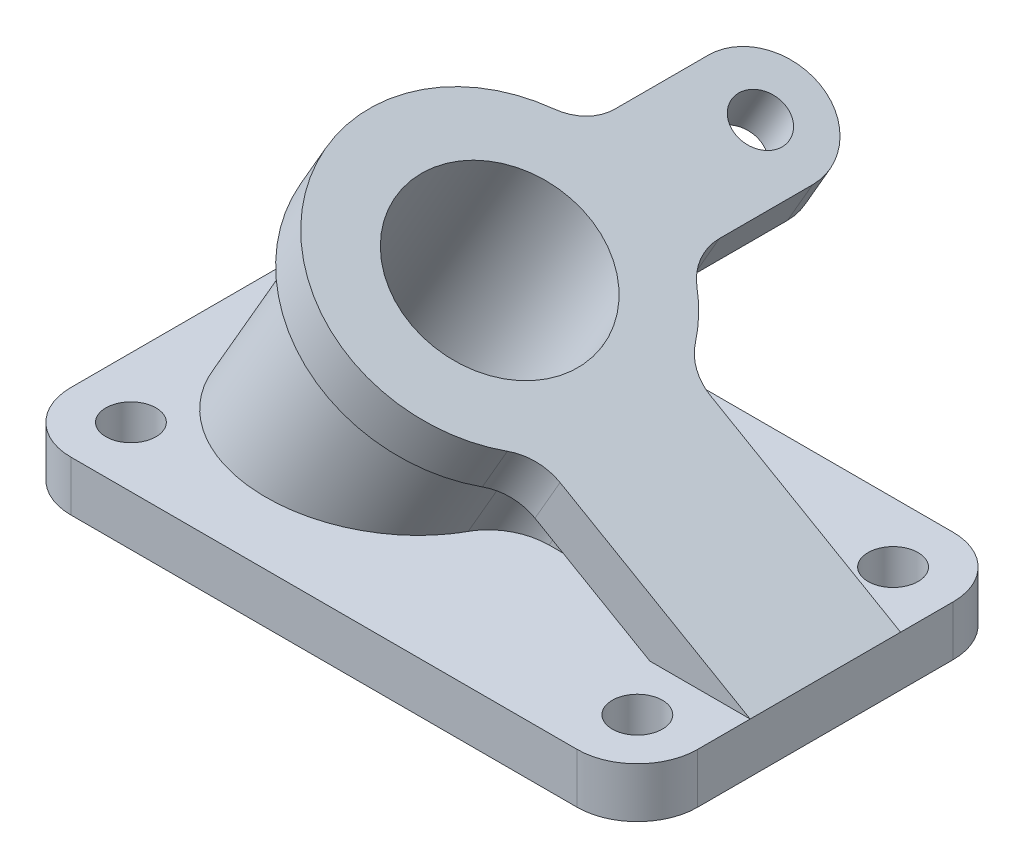
from build123d import *

# Parameters (mm, degrees)
SKETCH_7_R          = 5
EXTRUDE_5_DEPTH     = 10
CUT_EXTRUDE_3_DEPTH = 4
SKETCH_8_R          = 5
EXTRUDE_8_DEPTH     = 10
EXTRUDE_9_REACH     = 111.952
SKETCH_8_6_R        = 18
CUT_EXTRUDE_5_REACH = 111.952
SKETCH_8_7_R        = 18
RIB_9_REACH         = 119.31
SKETCH_10_WALL_W    = 268.526863554
SKETCH_10_WALL_H    = 10


with BuildPart() as part:
    # 草图7 → 凸台-拉伸5 (new body)
    with BuildSketch(Plane(origin=(0, 0, 0), x_dir=(1, 0, 0), z_dir=(0, 1, 0))):
        with BuildLine():
            Line((50.5, 37.5), (-50.5, 37.5))
            ThreePointArc((-50.5, 37.5), (-58.985281374, 33.985281374), (-62.5, 25.5))
            Line((-62.5, 25.5), (-62.5, -25.5))
            ThreePointArc((-62.5, -25.5), (-58.985281374, -33.985281374), (-50.5, -37.5))
            Line((-50.5, -37.5), (50.5, -37.5))
            ThreePointArc((50.5, -37.5), (58.985281374, -33.985281374), (62.5, -25.5))
            Line((62.5, -25.5), (62.5, 25.5))
            ThreePointArc((62.5, 25.5), (58.985281374, 33.985281374), (50.5, 37.5))
        make_face()
        with Locations((-50.5, -25.5)):
            Circle(SKETCH_7_R, mode=Mode.SUBTRACT)
        with Locations((50.5, -25.5)):
            Circle(SKETCH_7_R, mode=Mode.SUBTRACT)
        with Locations((-50.5, 25.5)):
            Circle(SKETCH_7_R, mode=Mode.SUBTRACT)
        with Locations((50.5, 25.5)):
            Circle(SKETCH_7_R, mode=Mode.SUBTRACT)
    extrude(amount=EXTRUDE_5_DEPTH)

    # 草图7<3> → 切除-拉伸3 (cut)
    with BuildSketch(Plane(origin=(0, 0, 0), x_dir=(1, 0, 0), z_dir=(0, 1, 0))):
        with BuildLine():
            Line((38.5, 25.5), (-38.5, 25.5))
            ThreePointArc((-38.5, 25.5), (-42.014718626, 17.014718626), (-50.5, 13.5))
            Line((-50.5, 13.5), (-50.5, -13.5))
            ThreePointArc((-50.5, -13.5), (-42.014718626, -17.014718626), (-38.5, -25.5))
            Line((-38.5, -25.5), (38.5, -25.5))
            ThreePointArc((38.5, -25.5), (42.014718626, -17.014718626), (50.5, -13.5))
            Line((50.5, -13.5), (50.5, 13.5))
            ThreePointArc((50.5, 13.5), (42.014718626, 17.014718626), (38.5, 25.5))
        make_face()
    extrude(amount=CUT_EXTRUDE_3_DEPTH, mode=Mode.SUBTRACT)

    # 草图8 → 凸台-拉伸8 (add)
    with BuildSketch(Plane(origin=(19.955127019, 34.563293868, 0), x_dir=(0, 0, 1), z_dir=(0.500000000000001, 0.866025403784438, 0))):
        with BuildLine():
            Line((-5, 5.749364338), (-5, 49.126587737))
            Line((-5, 49.126587737), (-15, 49.126587737))
            Line((-15, 49.126587737), (-15, 5.351577729))
            ThreePointArc((-15, 5.351577729), (-15.986121811, 1.02145071), (-18.75, -2.454669769))
            ThreePointArc((-18.75, -2.454669769), (-22.173981002, -5.666617205), (-25.054939633, -9.373412263))
            ThreePointArc((-25.054939633, -9.373412263), (-28.663169687, -12.676820694), (-33.406586177, -13.873412263))
            Line((-33.406586177, -13.873412263), (-52, -13.873412263))
            ThreePointArc((-52, -13.873412263), (-64, -25.873412263), (-52, -37.873412263))
            Line((-52, -37.873412263), (-33.406586177, -37.873412263))
            ThreePointArc((-33.406586177, -37.873412263), (-28.663169687, -39.070003833), (-25.054939633, -42.373412263))
            ThreePointArc((-25.054939633, -42.373412263), (20.206795058, -48.047393266), (18.75, -2.454669769))
            ThreePointArc((18.75, -2.454669769), (15.986121811, 1.02145071), (15, 5.351577729))
            Line((15, 5.351577729), (15, 49.126587737))
            Line((15, 49.126587737), (5, 49.126587737))
            Line((5, 49.126587737), (5, 5.749364338))
            ThreePointArc((5, 5.749364338), (6.548457453, 0.4041395), (10.714285714, -3.285714691))
            ThreePointArc((10.714285714, -3.285714691), (0, -50.873412263), (-10.714285714, -3.285714691))
            ThreePointArc((-10.714285714, -3.285714691), (-6.548457453, 0.4041395), (-5, 5.749364338))
        make_face()
        with Locations((-52, -25.873412263)):
            Circle(SKETCH_8_R, mode=Mode.SUBTRACT)
    extrude(amount=-EXTRUDE_8_DEPTH)

    # 草图8<6> → 凸台-拉伸9 (add, up to next)
    with BuildSketch(Plane(origin=(19.955127019, 34.563293868, 0), x_dir=(0, 0, 1), z_dir=(0.500000000000001, 0.866025403784438, 0)), mode=Mode.PRIVATE) as extrude_9_sk1:
        with BuildLine():
            Line((5, 49.126587737), (-5, 49.126587737))
            Line((-5, 49.126587737), (-5, 5.749364338))
            ThreePointArc((-5, 5.749364338), (-6.548457453, 0.4041395), (-10.714285714, -3.285714691))
            ThreePointArc((-10.714285714, -3.285714691), (0, -50.873412263), (10.714285714, -3.285714691))
            ThreePointArc((10.714285714, -3.285714691), (6.548457453, 0.4041395), (5, 5.749364338))
            Line((5, 5.749364338), (5, 49.126587737))
        make_face()
        with Locations((0, -25.873412263)):
            Circle(SKETCH_8_6_R, mode=Mode.SUBTRACT)
    extrude_9_tool1 = extrude(extrude_9_sk1.sketch, amount=-EXTRUDE_9_REACH, mode=Mode.PRIVATE) - part.part
    add(extrude_9_tool1.solids().sort_by_distance((43.717111, 20.844306, 3.881966))[0])

    # 草图8<7> → 切除-拉伸5 (cut, up to next)
    with BuildSketch(Plane(origin=(19.955127019, 34.563293868, 0), x_dir=(0, 0, 1), z_dir=(0.500000000000001, 0.866025403784438, 0)), mode=Mode.PRIVATE) as cut_extrude_5_sk1:
        with Locations((0, -25.873412263)):
            Circle(SKETCH_8_7_R)
    cut_extrude_5_tool1 = extrude(cut_extrude_5_sk1.sketch, amount=-CUT_EXTRUDE_5_REACH, mode=Mode.PRIVATE) & part.part
    add(cut_extrude_5_tool1.solids().sort_by_distance((-2.451905, 47.5, 0))[0], mode=Mode.SUBTRACT)

    # 草图10 wall → 筋9 (add, up to next)
    with BuildSketch(Plane(origin=(-14.201905284, 27.148403011, -33.5), x_dir=(-0.423116420047, -0.732859137032, 0.532813269688), z_dir=(0.266406634844, 0.461429827024, 0.846232840088)), mode=Mode.PRIVATE) as rib_9_sk1:
        Rectangle(SKETCH_10_WALL_W, SKETCH_10_WALL_H)
    rib_9_tool1 = extrude(rib_9_sk1.sketch, amount=RIB_9_REACH, mode=Mode.PRIVATE) - part.part
    add(rib_9_tool1.solids().sort_by_distance((-14.201905284, 27.148403011, -33.5))[0])


solid = part.part
